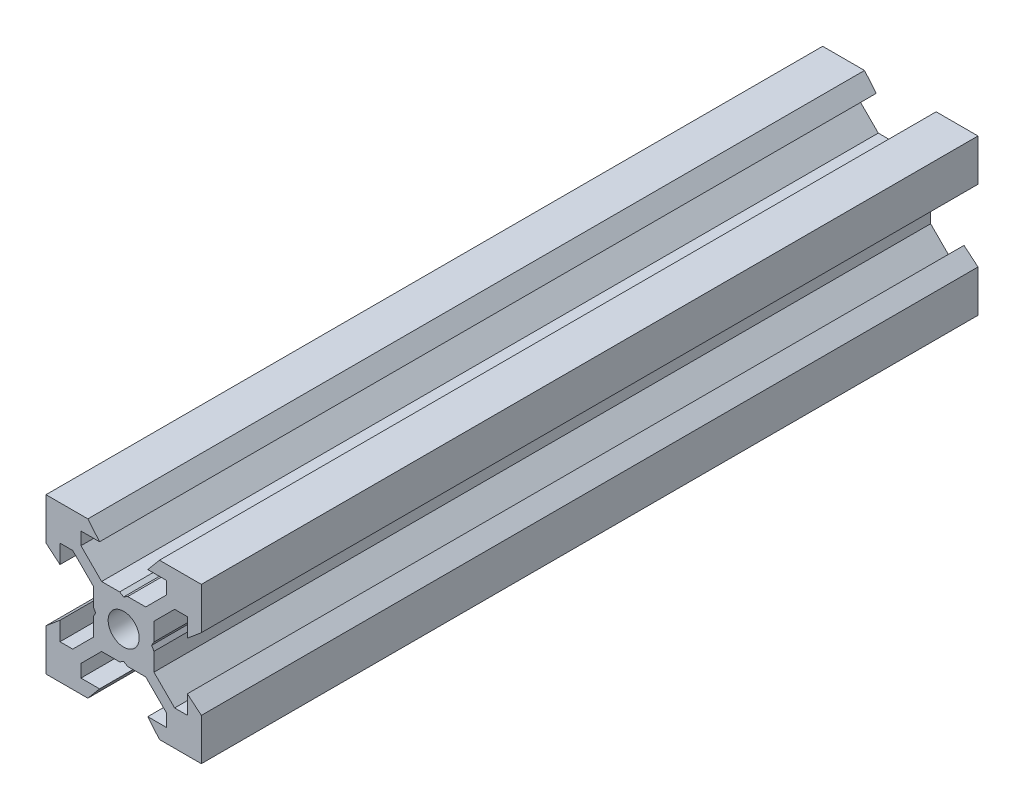
from build123d import *

# Parameters (mm, degrees)
SKETCH1_R           = 2
BOSS_EXTRUDE1_DEPTH = 50


with BuildPart() as part:
    # Sketch1 → Boss-Extrude1 (new, symmetric)
    with BuildSketch(Plane.XY):
        Polygon((10, 10), (10, 4.610379336), (8.2, 3.1), (8.2, 5.5), (6.560660172, 5.5), (3.9, 2.839339828), (3.9, 0.519615242), (3.6, 0), (3.9, -0.519615242), (3.9, -2.839339828), (6.560660172, -5.5), (8.2, -5.5), (8.2, -3.1), (10, -4.610379336), (10, -10), (4.610379336, -10), (3.1, -8.2), (5.5, -8.2), (5.5, -6.560660172), (2.839339828, -3.9), (0.519615242, -3.9), (0, -3.6), (-0.519615242, -3.9), (-2.839339828, -3.9), (-5.5, -6.560660172), (-5.5, -8.2), (-3.1, -8.2), (-4.610379336, -10), (-10, -10), (-10, -4.610379336), (-8.2, -3.1), (-8.2, -5.5), (-6.560660172, -5.5), (-3.9, -2.839339828), (-3.9, -0.519615242), (-3.6, 0), (-3.9, 0.519615242), (-3.9, 2.839339828), (-6.560660172, 5.5), (-8.2, 5.5), (-8.2, 3.1), (-10, 4.610379336), (-10, 10), (-4.610379336, 10), (-3.1, 8.2), (-5.5, 8.2), (-5.5, 6.560660172), (-2.839339828, 3.9), (-0.519615242, 3.9), (0, 3.6), (0.519615242, 3.9), (2.839339828, 3.9), (5.5, 6.560660172), (5.5, 8.2), (3.1, 8.2), (4.610379336, 10), align=None)
        Circle(SKETCH1_R, mode=Mode.SUBTRACT)
    extrude(amount=BOSS_EXTRUDE1_DEPTH, both=True)


solid = part.part
